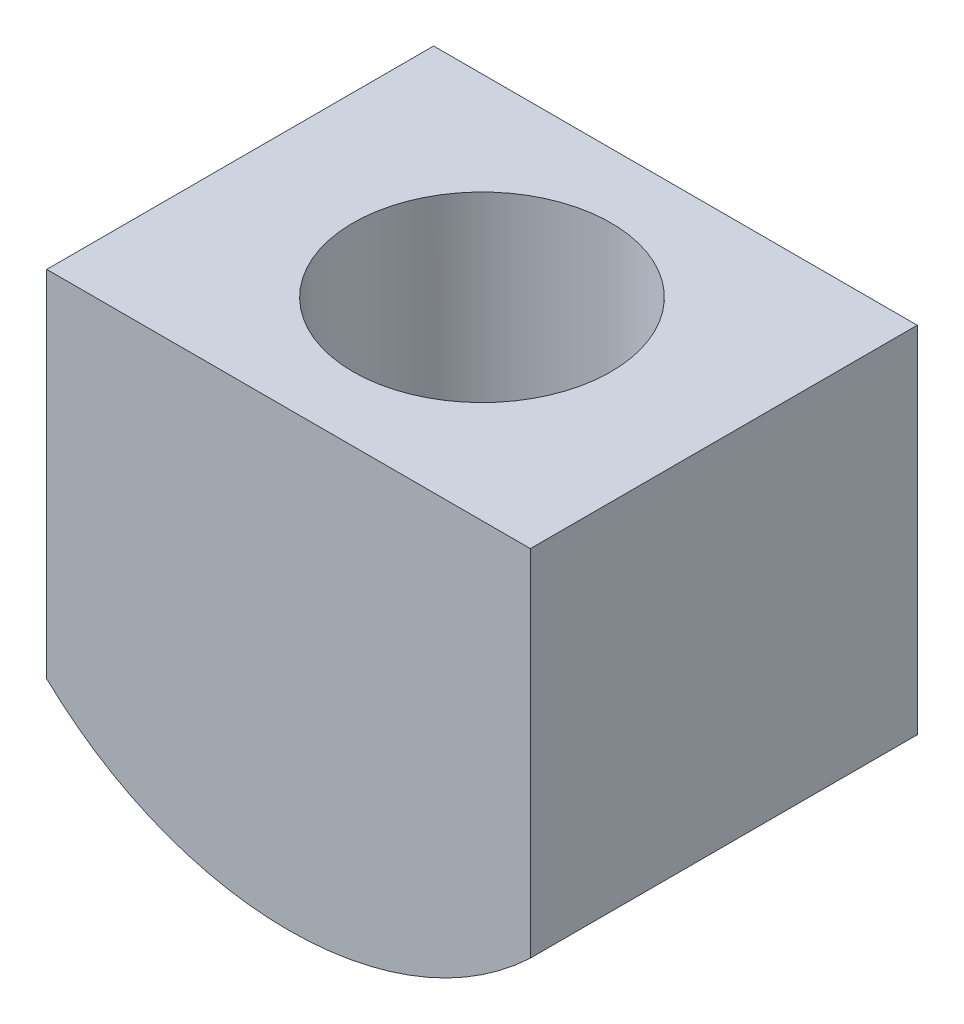
from build123d import *

# Parameters (mm, degrees)
DODANIE_WYCI_GNI_CIE1_DEPTH = 12
SZKIC2_R                    = 4
WYTNIJ_WYCI_GNI_CIE1_DEPTH  = 21


with BuildPart() as part:
    # Szkic1 → Dodanie-wyciągnięcie1 (new body)
    with BuildSketch(Plane.XY):
        with BuildLine():
            Line((0, 0), (15, 0))
            Line((15, 0), (15, -11))
            ThreePointArc((15, -11), (7.5, -14), (0, -11))
            Line((0, -11), (0, 0))
        make_face()
    extrude(amount=DODANIE_WYCI_GNI_CIE1_DEPTH)

    # Szkic2 → Wytnij-wyciągnięcie1 (cut)
    with BuildSketch(Plane(origin=(0, 0, 0), x_dir=(1, 0, 0), z_dir=(0, 1, 0))):
        with Locations(Location((7.5, -6, 0), (0, 0, 270))):
            Circle(SZKIC2_R)
    extrude(amount=-WYTNIJ_WYCI_GNI_CIE1_DEPTH, mode=Mode.SUBTRACT)


solid = part.part
